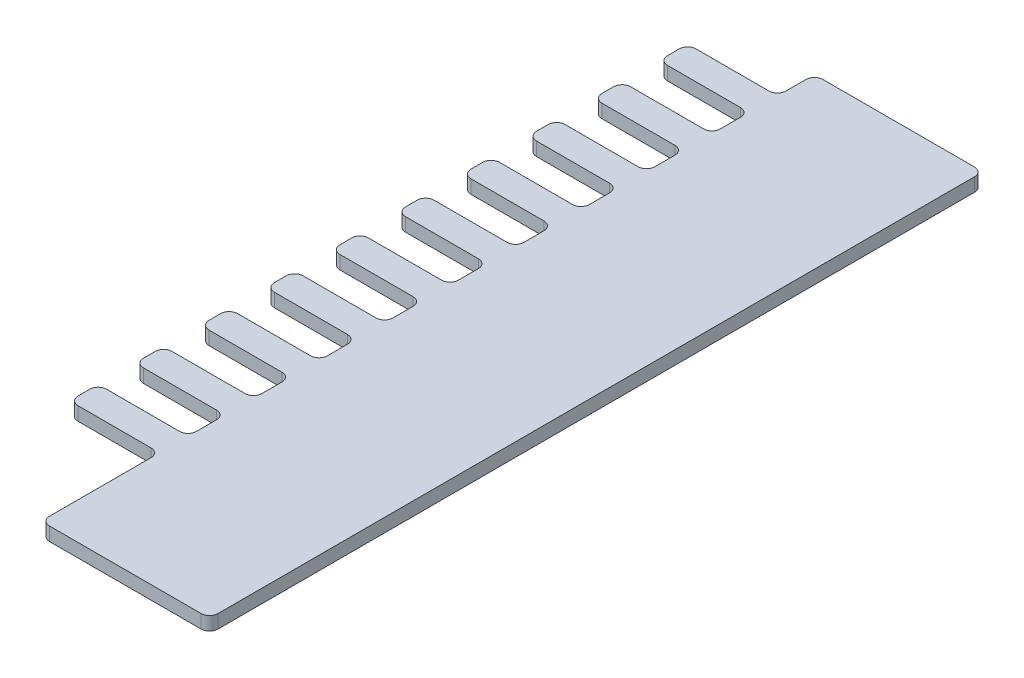
from build123d import *

# Parameters (mm, degrees)
BOSS_EXTRUDE1_DEPTH = 1.2


with BuildPart() as part:
    # Sketch1 → Boss-Extrude1 (new body)
    with BuildSketch(Plane(origin=(0, 0, 0), x_dir=(1, 0, 0), z_dir=(0, 1, 0))):
        with BuildLine():
            Line((-0.75, 2.54), (-7.25, 2.54))
            ThreePointArc((-7.25, 2.54), (-7.780330086, 2.759669914), (-8, 3.29))
            Line((-8, 3.29), (-8, 4.33))
            ThreePointArc((-8, 4.33), (-7.780330086, 4.860330086), (-7.25, 5.08))
            Line((-7.25, 5.08), (-0.75, 5.08))
            ThreePointArc((-0.75, 5.08), (-0.219669914, 5.299669914), (0, 5.83))
            Line((0, 5.83), (0, 7.62000013))
            ThreePointArc((0, 7.62000013), (-0.219669914, 8.150330216), (-0.75, 8.37000013))
            Line((-0.75, 8.37000013), (-7.25, 8.37000013))
            ThreePointArc((-7.25, 8.37000013), (-7.780330086, 8.589670044), (-8, 9.12000013))
            Line((-8, 9.12000013), (-8, 10.16000013))
            ThreePointArc((-8, 10.16000013), (-7.780330086, 10.690330216), (-7.25, 10.91000013))
            Line((-7.25, 10.91000013), (-0.75, 10.91000013))
            ThreePointArc((-0.75, 10.91000013), (-0.219669868, 11.12967009), (0, 11.66000026))
            Line((0, 11.66000026), (0, 13.45000026))
            ThreePointArc((0, 13.45000026), (-0.219669914, 13.980330346), (-0.75, 14.20000026))
            Line((-0.75, 14.20000026), (-7.25, 14.20000026))
            ThreePointArc((-7.25, 14.20000026), (-7.780330086, 14.419670174), (-8, 14.95000026))
            Line((-8, 14.95000026), (-8, 15.99000026))
            ThreePointArc((-8, 15.99000026), (-7.780330086, 16.520330346), (-7.25, 16.74000026))
            Line((-7.25, 16.74000026), (-0.75, 16.74000026))
            ThreePointArc((-0.75, 16.74000026), (-0.219669868, 16.95967022), (0, 17.49000039))
            Line((0, 17.49000039), (0, 19.28000039))
            ThreePointArc((0, 19.28000039), (-0.219669914, 19.810330476), (-0.75, 20.03000039))
            Line((-0.75, 20.03000039), (-7.25, 20.03000039))
            ThreePointArc((-7.25, 20.03000039), (-7.780330086, 20.249670304), (-8, 20.78000039))
            Line((-8, 20.78000039), (-8, 21.82000039))
            ThreePointArc((-8, 21.82000039), (-7.780330086, 22.350330476), (-7.25, 22.57000039))
            Line((-7.25, 22.57000039), (-0.75, 22.57000039))
            ThreePointArc((-0.75, 22.57000039), (-0.219669868, 22.78967035), (0, 23.32000052))
            Line((0, 23.32000052), (0, 25.11000052))
            ThreePointArc((0, 25.11000052), (-0.219669914, 25.640330606), (-0.75, 25.86000052))
            Line((-0.75, 25.86000052), (-7.25, 25.86000052))
            ThreePointArc((-7.25, 25.86000052), (-7.780330086, 26.079670434), (-8, 26.61000052))
            Line((-8, 26.61000052), (-8, 27.65000052))
            ThreePointArc((-8, 27.65000052), (-7.780330086, 28.180330606), (-7.25, 28.40000052))
            Line((-7.25, 28.40000052), (-0.75, 28.40000052))
            ThreePointArc((-0.75, 28.40000052), (-0.219669868, 28.61967048), (0, 29.15000065))
            Line((0, 29.15000065), (0, 30.94000065))
            ThreePointArc((0, 30.94000065), (-0.219669914, 31.470330736), (-0.75, 31.69000065))
            Line((-0.75, 31.69000065), (-7.25, 31.69000065))
            ThreePointArc((-7.25, 31.69000065), (-7.780330086, 31.909670564), (-8, 32.44000065))
            Line((-8, 32.44000065), (-8, 33.48000065))
            ThreePointArc((-8, 33.48000065), (-7.780330086, 34.010330736), (-7.25, 34.23000065))
            Line((-7.25, 34.23000065), (-0.75, 34.23000065))
            ThreePointArc((-0.75, 34.23000065), (-0.219669868, 34.44967061), (0, 34.98000078))
            Line((0, 34.98000078), (0, 36.77000078))
            ThreePointArc((0, 36.77000078), (-0.219669914, 37.300330866), (-0.75, 37.52000078))
            Line((-0.75, 37.52000078), (-7.25, 37.52000078))
            ThreePointArc((-7.25, 37.52000078), (-7.780330086, 37.739670694), (-8, 38.27000078))
            Line((-8, 38.27000078), (-8, 39.31000078))
            ThreePointArc((-8, 39.31000078), (-7.780330086, 39.840330866), (-7.25, 40.06000078))
            Line((-7.25, 40.06000078), (-0.75, 40.06000078))
            ThreePointArc((-0.75, 40.06000078), (-0.219669868, 40.27967074), (0, 40.81000091))
            Line((0, 40.81000091), (0, 42.60000091))
            ThreePointArc((0, 42.60000091), (-0.219669914, 43.130330995), (-0.75, 43.35000091))
            Line((-0.75, 43.35000091), (-7.25, 43.35000091))
            ThreePointArc((-7.25, 43.35000091), (-7.780330086, 43.569670824), (-8, 44.10000091))
            Line((-8, 44.10000091), (-8, 45.14000091))
            ThreePointArc((-8, 45.14000091), (-7.780330086, 45.670330995), (-7.25, 45.89000091))
            Line((-7.25, 45.89000091), (-0.75, 45.89000091))
            ThreePointArc((-0.75, 45.89000091), (-0.219669868, 46.10967087), (0, 46.64000104))
            Line((0, 46.64000104), (0, 48.43000104))
            ThreePointArc((0, 48.43000104), (-0.219669914, 48.960331125), (-0.75, 49.18000104))
            Line((-0.75, 49.18000104), (-7.25, 49.18000104))
            ThreePointArc((-7.25, 49.18000104), (-7.780330086, 49.399670954), (-8, 49.93000104))
            Line((-8, 49.93000104), (-8, 50.97000104))
            ThreePointArc((-8, 50.97000104), (-7.780330086, 51.500331125), (-7.25, 51.72000104))
            Line((-7.25, 51.72000104), (-0.75, 51.72000104))
            ThreePointArc((-0.75, 51.72000104), (-0.219669868, 51.939671), (0, 52.470001169))
            Line((0, 52.470001169), (0, 54.260001169))
            ThreePointArc((0, 54.260001169), (-0.219669914, 54.790331255), (-0.75, 55.010001169))
            Line((-0.75, 55.010001169), (-7.25, 55.010001169))
            ThreePointArc((-7.25, 55.010001169), (-7.780330086, 55.229671084), (-8, 55.760001169))
            Line((-8, 55.760001169), (-8, 56.800001169))
            ThreePointArc((-8, 56.800001169), (-7.780330086, 57.330331255), (-7.25, 57.550001169))
            Line((-7.25, 57.550001169), (-0.75, 57.550001169))
            ThreePointArc((-0.75, 57.550001169), (-0.219669914, 57.769671084), (0, 58.300001169))
            Line((0, 58.300001169), (0, 60.090001169))
            ThreePointArc((0, 60.090001169), (0.219669914, 60.620331255), (0.75, 60.840001169))
            Line((0.75, 60.840001169), (14.25, 60.840001169))
            ThreePointArc((14.25, 60.840001169), (14.780330086, 60.620331255), (15, 60.090001169))
            Line((15, 60.090001169), (15, 0))
            Line((15, 0), (15, -7.25))
            ThreePointArc((15, -7.25), (14.780330086, -7.780330086), (14.25, -8))
            Line((14.25, -8), (0.75, -8))
            ThreePointArc((0.75, -8), (0.219669914, -7.780330086), (0, -7.25))
            Line((0, -7.25), (0, 0))
            Line((0, 0), (0, 1.79))
            ThreePointArc((0, 1.79), (-0.219669914, 2.320330086), (-0.75, 2.54))
        make_face()
    extrude(amount=BOSS_EXTRUDE1_DEPTH)


solid = part.part
